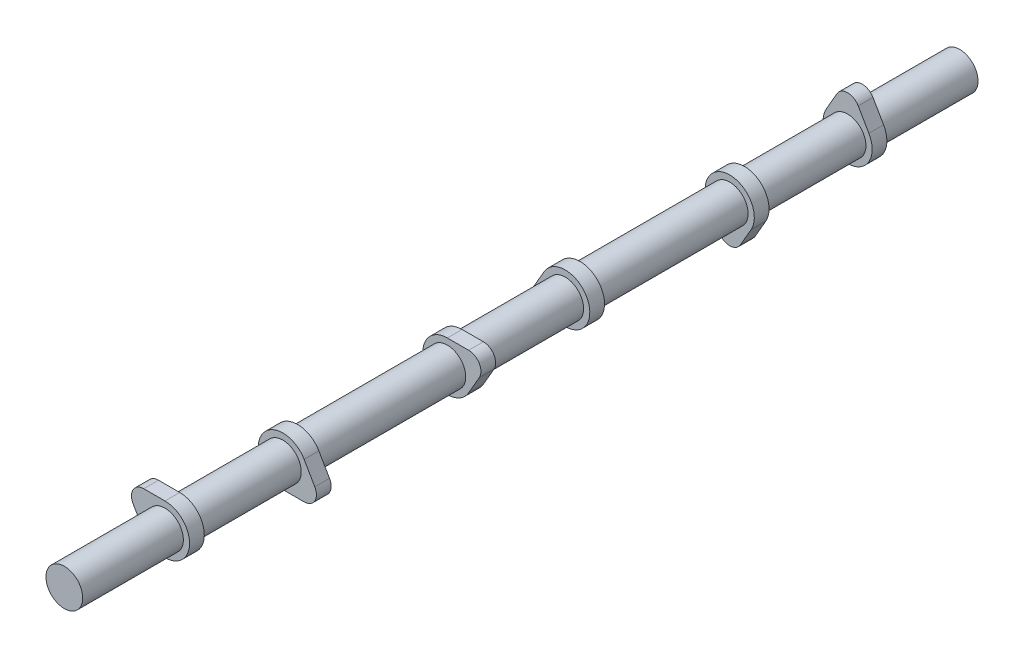
from build123d import *

# Parameters (mm, degrees)
BOSS_EXTRUDE1_DEPTH   = 7.62
BODY_MOVE_COPY2_ANGLE = 180
BOSS_EXTRUDE2_START   = -25.4
SKETCH2_R             = 9.5
BOSS_EXTRUDE2_DEPTH   = 146.05
LPATTERN1_COUNT       = 3
LPATTERN1_PITCH       = 146.05
BODY_MOVE_COPY3_ANGLE = 120
BODY_MOVE_COPY4_ANGLE = 120
BOSS_EXTRUDE3_START   = 24.94
SKETCH3_R             = 9.5
BOSS_EXTRUDE3_DEPTH   = 24.94


with BuildPart() as part:
    # Sketch1 → Boss-Extrude1 (new body)
    with BuildSketch(Plane.XY):
        with BuildLine():
            Line((-5.499261314, 15.875), (-10.998522628, 6.35))
            ThreePointArc((-10.998522628, 6.35), (0, -12.7), (10.998522628, 6.35))
            Line((10.998522628, 6.35), (5.499261314, 15.875))
            ThreePointArc((5.499261314, 15.875), (0, 19.05), (-5.499261314, 15.875))
        make_face()
    extrude(amount=BOSS_EXTRUDE1_DEPTH)


with BuildPart() as body_2:
    # Body-Move/Copy1: copy of part
    add(part.part.moved(Location((0, 0, 60.96))))


with BuildPart() as body_2_1:
    # Body-Move/Copy2: moved
    add(body_2.part.rotate(Axis((0, 0, 0), (0, 0, 1)), BODY_MOVE_COPY2_ANGLE))


with BuildPart() as part_1:
    add(part.part)

    add(body_2_1.part)  # Boss-Extrude2 merges body 2
    # Sketch2 → Boss-Extrude2 (add)
    with BuildSketch(Plane.XY.offset(BOSS_EXTRUDE2_START)):
        Circle(SKETCH2_R)
    extrude(amount=BOSS_EXTRUDE2_DEPTH)


with BuildPart() as lpattern1_1:
    # LPattern1: pattern copy
    add(part_1.part.moved(Location(Vector(0, 0, 1) * (1 * LPATTERN1_PITCH))))


with BuildPart() as lpattern1_2:
    # LPattern1: pattern copy
    add(part_1.part.moved(Location(Vector(0, 0, 1) * (2 * LPATTERN1_PITCH))))


with BuildPart() as lpattern1_1_1:
    # Body-Move/Copy3: moved
    add(lpattern1_1.part.rotate(Axis((0, 0, 0), (0, 0, 1)), BODY_MOVE_COPY3_ANGLE))


with BuildPart() as lpattern1_2_1:
    # Body-Move/Copy4: moved
    add(lpattern1_2.part.rotate(Axis((0, 0, 0), (0, 0, -1)), BODY_MOVE_COPY4_ANGLE))


with BuildPart() as part_2:
    add(part_1.part)

    # Sketch3 → Boss-Extrude3 (add)
    with BuildSketch(Plane(origin=(0, 0, -25.4), x_dir=(-1, 0, 0), z_dir=(0, 0, -1)).offset(BOSS_EXTRUDE3_START)):
        Circle(SKETCH3_R)
    extrude(amount=-BOSS_EXTRUDE3_DEPTH)

    # Combine1: union LPattern1_1, LPattern1_2
    add(lpattern1_1_1.part)
    add(lpattern1_2_1.part)


solid = part_2.part
